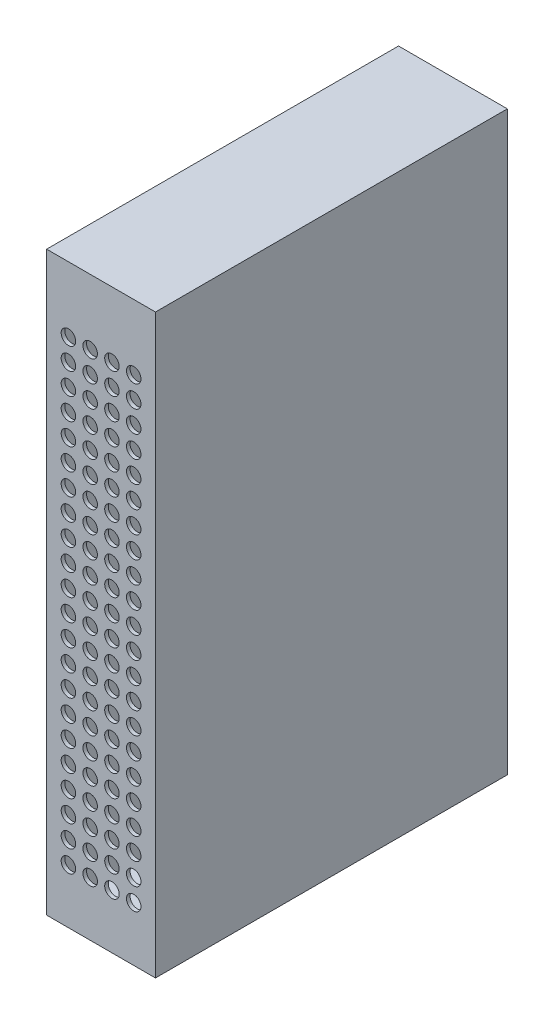
from build123d import *

# Parameters (mm, degrees)
SKETCH1_W         = 30
SKETCH1_H         = 159
CASE_2_DEPTH      = 97
CASE_SHELL_T      = 1
SKETCH2_R         = 2
PERFORATION_DEPTH = 1


with BuildPart() as part:
    # Sketch1 → Case 2 (new body)
    with BuildSketch(Plane.XY):
        with Locations((0, 79.5)):
            Rectangle(SKETCH1_W, SKETCH1_H)
    extrude(amount=CASE_2_DEPTH)

    # Case_shell (no face opened: a closed hollow body)
    add(offset(amount=-CASE_SHELL_T, mode=Mode.PRIVATE), mode=Mode.SUBTRACT)

    # Sketch2 → Perforation (cut)
    with BuildSketch(Plane.XY.offset(97)):
        with Locations((-9, 15)):
            Circle(SKETCH2_R)
        with Locations((-9, 21)):
            Circle(SKETCH2_R)
        with Locations((-9, 27)):
            Circle(SKETCH2_R)
        with Locations((-9, 33)):
            Circle(SKETCH2_R)
        with Locations((-9, 39)):
            Circle(SKETCH2_R)
        with Locations((-9, 45)):
            Circle(SKETCH2_R)
        with Locations((-9, 51)):
            Circle(SKETCH2_R)
        with Locations((-9, 57)):
            Circle(SKETCH2_R)
        with Locations((-9, 63)):
            Circle(SKETCH2_R)
        with Locations((-9, 69)):
            Circle(SKETCH2_R)
        with Locations((-9, 75)):
            Circle(SKETCH2_R)
        with Locations((-9, 81)):
            Circle(SKETCH2_R)
        with Locations((-9, 87)):
            Circle(SKETCH2_R)
        with Locations((-9, 93)):
            Circle(SKETCH2_R)
        with Locations((-9, 99)):
            Circle(SKETCH2_R)
        with Locations((-9, 105)):
            Circle(SKETCH2_R)
        with Locations((-9, 111)):
            Circle(SKETCH2_R)
        with Locations((-9, 117)):
            Circle(SKETCH2_R)
        with Locations((-9, 123)):
            Circle(SKETCH2_R)
        with Locations((-9, 129)):
            Circle(SKETCH2_R)
        with Locations((-9, 135)):
            Circle(SKETCH2_R)
        with Locations((-9, 141)):
            Circle(SKETCH2_R)
        with Locations((-3, 15)):
            Circle(SKETCH2_R)
        with Locations((-3, 21)):
            Circle(SKETCH2_R)
        with Locations((-3, 27)):
            Circle(SKETCH2_R)
        with Locations((-3, 33)):
            Circle(SKETCH2_R)
        with Locations((-3, 39)):
            Circle(SKETCH2_R)
        with Locations((-3, 45)):
            Circle(SKETCH2_R)
        with Locations((-3, 51)):
            Circle(SKETCH2_R)
        with Locations((-3, 57)):
            Circle(SKETCH2_R)
        with Locations((-3, 63)):
            Circle(SKETCH2_R)
        with Locations((-3, 69)):
            Circle(SKETCH2_R)
        with Locations((-3, 75)):
            Circle(SKETCH2_R)
        with Locations((-3, 81)):
            Circle(SKETCH2_R)
        with Locations((-3, 87)):
            Circle(SKETCH2_R)
        with Locations((-3, 93)):
            Circle(SKETCH2_R)
        with Locations((-3, 99)):
            Circle(SKETCH2_R)
        with Locations((-3, 105)):
            Circle(SKETCH2_R)
        with Locations((-3, 111)):
            Circle(SKETCH2_R)
        with Locations((-3, 117)):
            Circle(SKETCH2_R)
        with Locations((-3, 123)):
            Circle(SKETCH2_R)
        with Locations((-3, 129)):
            Circle(SKETCH2_R)
        with Locations((-3, 135)):
            Circle(SKETCH2_R)
        with Locations((-3, 141)):
            Circle(SKETCH2_R)
        with Locations((3, 15)):
            Circle(SKETCH2_R)
        with Locations((3, 21)):
            Circle(SKETCH2_R)
        with Locations((3, 27)):
            Circle(SKETCH2_R)
        with Locations((3, 33)):
            Circle(SKETCH2_R)
        with Locations((3, 39)):
            Circle(SKETCH2_R)
        with Locations((3, 45)):
            Circle(SKETCH2_R)
        with Locations((3, 51)):
            Circle(SKETCH2_R)
        with Locations((3, 57)):
            Circle(SKETCH2_R)
        with Locations((3, 63)):
            Circle(SKETCH2_R)
        with Locations((3, 69)):
            Circle(SKETCH2_R)
        with Locations((3, 75)):
            Circle(SKETCH2_R)
        with Locations((3, 81)):
            Circle(SKETCH2_R)
        with Locations((3, 87)):
            Circle(SKETCH2_R)
        with Locations((3, 93)):
            Circle(SKETCH2_R)
        with Locations((3, 99)):
            Circle(SKETCH2_R)
        with Locations((3, 105)):
            Circle(SKETCH2_R)
        with Locations((3, 111)):
            Circle(SKETCH2_R)
        with Locations((3, 117)):
            Circle(SKETCH2_R)
        with Locations((3, 123)):
            Circle(SKETCH2_R)
        with Locations((3, 129)):
            Circle(SKETCH2_R)
        with Locations((3, 135)):
            Circle(SKETCH2_R)
        with Locations((3, 141)):
            Circle(SKETCH2_R)
        with Locations((9, 15)):
            Circle(SKETCH2_R)
        with Locations((9, 21)):
            Circle(SKETCH2_R)
        with Locations((9, 27)):
            Circle(SKETCH2_R)
        with Locations((9, 33)):
            Circle(SKETCH2_R)
        with Locations((9, 39)):
            Circle(SKETCH2_R)
        with Locations((9, 45)):
            Circle(SKETCH2_R)
        with Locations((9, 51)):
            Circle(SKETCH2_R)
        with Locations((9, 57)):
            Circle(SKETCH2_R)
        with Locations((9, 63)):
            Circle(SKETCH2_R)
        with Locations((9, 69)):
            Circle(SKETCH2_R)
        with Locations((9, 75)):
            Circle(SKETCH2_R)
        with Locations((9, 81)):
            Circle(SKETCH2_R)
        with Locations((9, 87)):
            Circle(SKETCH2_R)
        with Locations((9, 93)):
            Circle(SKETCH2_R)
        with Locations((9, 99)):
            Circle(SKETCH2_R)
        with Locations((9, 105)):
            Circle(SKETCH2_R)
        with Locations((9, 111)):
            Circle(SKETCH2_R)
        with Locations((9, 117)):
            Circle(SKETCH2_R)
        with Locations((9, 123)):
            Circle(SKETCH2_R)
        with Locations((9, 129)):
            Circle(SKETCH2_R)
        with Locations((9, 135)):
            Circle(SKETCH2_R)
        with Locations((9, 141)):
            Circle(SKETCH2_R)
    extrude(amount=-PERFORATION_DEPTH, mode=Mode.SUBTRACT)


solid = part.part
